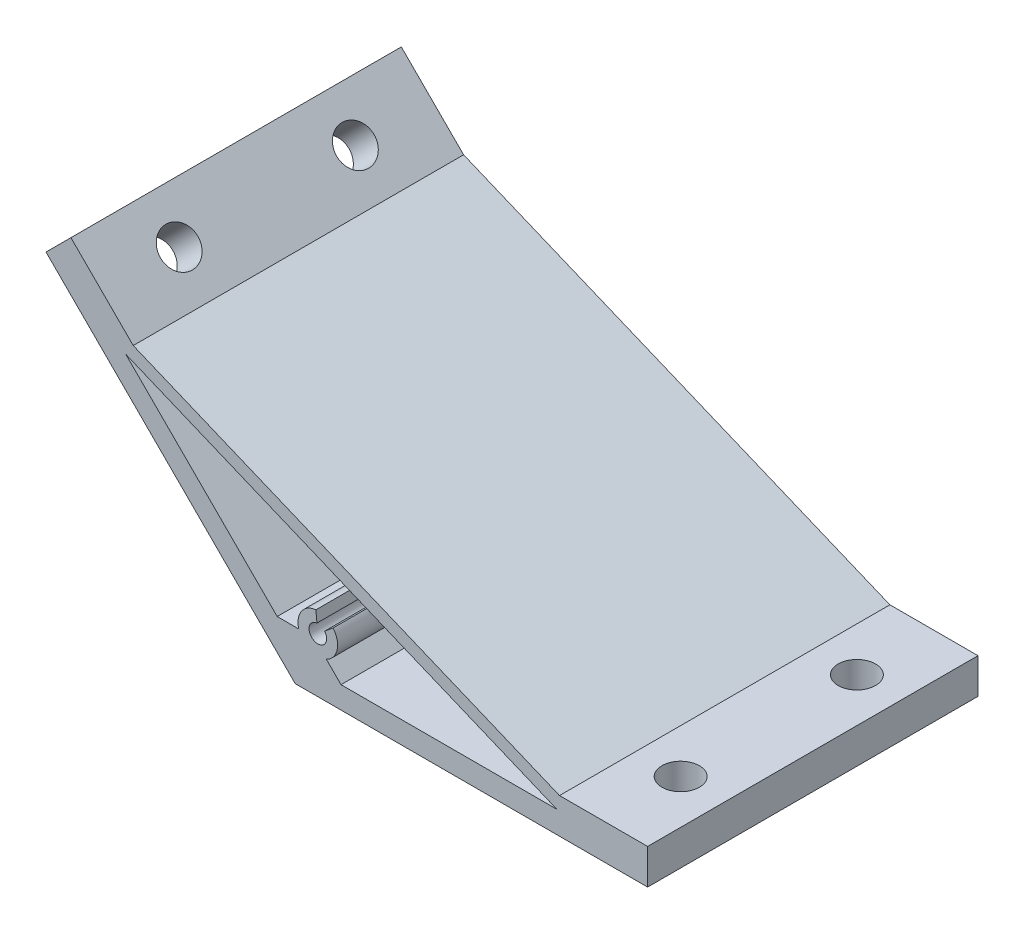
from build123d import *

# Parameters (mm, degrees)
EXTRUDE_1_DEPTH         = 37.5
HOLE_WIZARD_8_5_8_5_1_D = 8.5
HOLE_WIZARD_8_5_8_5_2_D = 8.5


with BuildPart() as part:
    # 草图1 → 凸台-拉伸1 (new, symmetric)
    with BuildSketch(Plane.XY):
        Polygon((6936.119122288, -1232.086390659), (6992.687664783, -1288.654933154), (7072.687664783, -1288.654933154), (7072.687664783, -1280.654933154), (7052.687664783, -1280.654933154), (6955.918112162, -1240.571672033), (6941.775976538, -1226.429536409), align=None)
        with BuildLine():
            Line((7009.090927681, -1283.654933154), (7003.090927681, -1283.654933154))
            Line((7003.090927681, -1283.654933154), (6999.760549745, -1280.324555218))
            ThreePointArc((6999.760549745, -1280.324555218), (7002.213755914, -1277.239517812), (7001.296666197, -1273.406161221))
            Line((7001.296666197, -1273.406161221), (6999.365595427, -1274.993916141))
            ThreePointArc((6999.365595427, -1274.993916141), (6997.055371947, -1278.111879141), (6997.626530039, -1274.273571671))
            Line((6997.626530039, -1274.273571671), (6997.383769074, -1271.785386165))
            ThreePointArc((6997.383769074, -1271.785386165), (6994.101203016, -1273.731324494), (6993.49338103, -1277.49861375))
            Line((6993.49338103, -1277.49861375), (6988.602413191, -1277.49861375))
            Line((6988.602413191, -1277.49861375), (6954.21874867, -1243.114949228))
            Line((6954.21874867, -1243.114949228), (7052.090927681, -1283.654933154))
            Line((7052.090927681, -1283.654933154), (7029.403393536, -1283.654933154))
            Line((7029.403393536, -1283.654933154), (7009.090927681, -1283.654933154))
        make_face(mode=Mode.SUBTRACT)
    extrude(amount=EXTRUDE_1_DEPTH, both=True)

    # Ø8.5 (8.5) 直径孔1 (through all)
    with Locations(Plane(origin=(2852.016365815, 2852.016365815, 0), x_dir=(0.7071067811865628, -0.7071067811865324, 0), z_dir=(-0.7071067811865324, -0.7071067811865628, 0))):
        with Locations((5785.79350833, -20), (5785.79350833, 20)):
            Hole(HOLE_WIZARD_8_5_8_5_1_D / 2)

    # Ø8.5 (8.5) 直径孔2 (through all)
    with Locations(Plane.XZ.offset(1288.654933154)):
        with Locations((7062.687664783, -20), (7062.687664783, 20)):
            Hole(HOLE_WIZARD_8_5_8_5_2_D / 2)


solid = part.part
